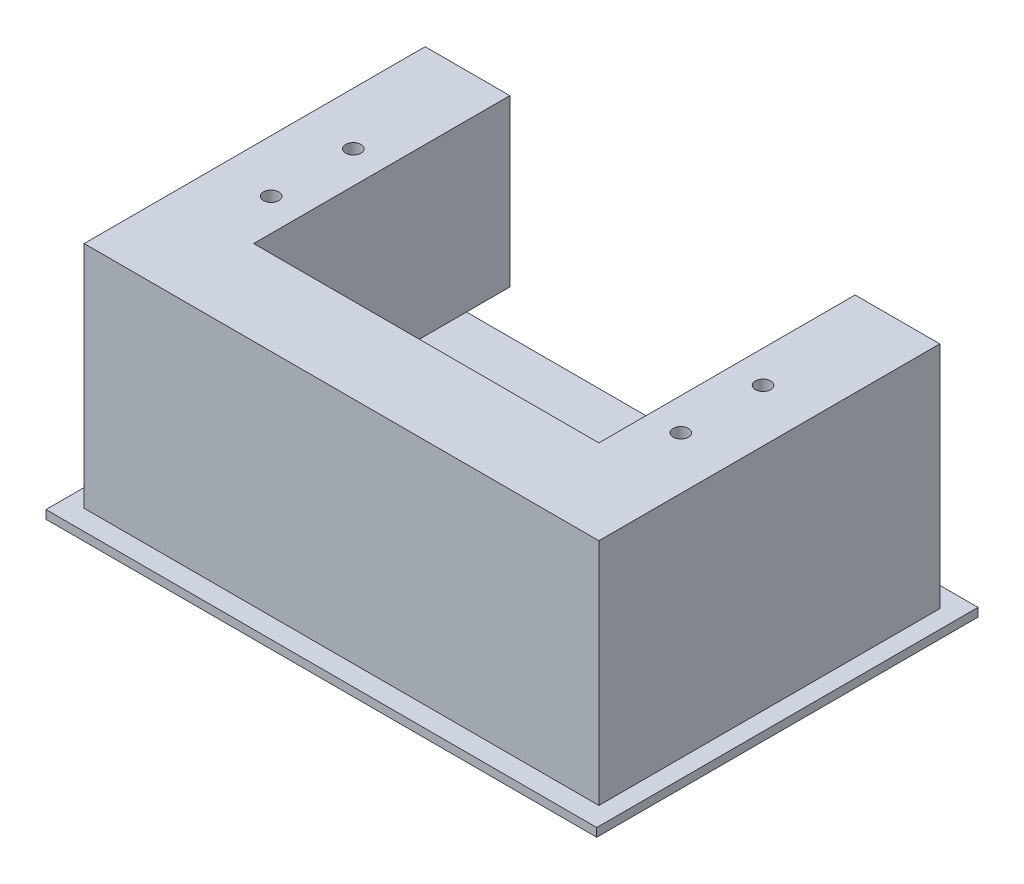
from build123d import *

# Parameters (mm, degrees)
SKETCH1_W           = 65
SKETCH1_H           = 45
BOSS_EXTRUDE1_DEPTH = 1
SKETCH2_W           = 10
SKETCH2_H           = 40.24
BOSS_EXTRUDE2_DEPTH = 27.06
CUT_EXTRUDE1_START  = -10
SKETCH3_R           = 0.9
CUT_EXTRUDE1_DEPTH  = 59.475391695
CUT_EXTRUDE2_REACH  = 74.435
SKETCH4_W           = 8.1
SKETCH4_H           = 7.5
SKETCH5_W           = 40.75
SKETCH5_H           = 10
BOSS_EXTRUDE3_DEPTH = 27.06
SKETCH6_W           = 16.07
SKETCH6_H           = 7.5
CUT_EXTRUDE3_DEPTH  = 50.75
SKETCH7_W           = 40.75
SKETCH7_H           = 10
CUT_EXTRUDE4_DEPTH  = 27.06


with BuildPart() as part:
    # Sketch1 → Boss-Extrude1 (new body)
    with BuildSketch(Plane(origin=(0, 0, 0), x_dir=(1, 0, 0), z_dir=(0, 1, 0))):
        Rectangle(SKETCH1_W, SKETCH1_H)
    extrude(amount=BOSS_EXTRUDE1_DEPTH)

    # Sketch2 → Boss-Extrude2 (add)
    with BuildSketch(Plane(origin=(0, 1, 0), x_dir=(1, 0, 0), z_dir=(0, 1, 0))):
        with Locations((25.375, 0)):
            Rectangle(SKETCH2_W, SKETCH2_H)
    boss_extrude2 = extrude(amount=BOSS_EXTRUDE2_DEPTH)

    # Sketch3 → Cut-Extrude1 (cut)
    with BuildSketch(Plane(origin=(0, 28.06, 0), x_dir=(1, 0, 0), z_dir=(0, 1, 0)).offset(CUT_EXTRUDE1_START)):
        with Locations(Location((24.175, 5.45, 0), (0, 0, 90))):
            Circle(SKETCH3_R)
        with Locations(Location((24.175, -4.25, 0), (0, 0, 90))):
            Circle(SKETCH3_R)
    cut_extrude1 = extrude(amount=CUT_EXTRUDE1_DEPTH, mode=Mode.SUBTRACT)

    # Mirror3: Boss-Extrude2, Cut-Extrude1 across plane
    add(boss_extrude2.mirror(Plane(origin=(0, 0, 0), x_dir=(0, 0, 1), z_dir=(1, 0, 0))))
    add(cut_extrude1.mirror(Plane(origin=(0, 0, 0), x_dir=(0, 0, 1), z_dir=(1, 0, 0))), mode=Mode.SUBTRACT)

    # Sketch4 → Cut-Extrude2 (cut, up to next)
    with BuildSketch(Plane.ZY.offset(30.375), mode=Mode.PRIVATE) as cut_extrude2_sk1:
        with Locations((0, 4.75)):
            Rectangle(SKETCH4_W, SKETCH4_H)
    cut_extrude2_tool1 = extrude(cut_extrude2_sk1.sketch, amount=-CUT_EXTRUDE2_REACH, mode=Mode.PRIVATE) & part.part
    add(cut_extrude2_tool1.solids().sort_by_distance((-30.375, 4.75, 0))[0], mode=Mode.SUBTRACT)

    # Sketch5 → Boss-Extrude3 (add)
    with BuildSketch(Plane(origin=(0, 1, 0), x_dir=(1, 0, 0), z_dir=(0, 1, 0))):
        with Locations((0, 15.12)):
            Rectangle(SKETCH5_W, SKETCH5_H)
    boss_extrude3 = extrude(amount=BOSS_EXTRUDE3_DEPTH)

    # Mirror4: Boss-Extrude3 across plane
    add(boss_extrude3.mirror(Plane.XY))

    # Sketch6 → Cut-Extrude3 (cut)
    with BuildSketch(Plane.ZY.offset(30.375)):
        with Locations((-12.085, 4.75)):
            Rectangle(SKETCH6_W, SKETCH6_H)
    extrude(amount=-CUT_EXTRUDE3_DEPTH, mode=Mode.SUBTRACT)

    # Sketch7 → Cut-Extrude4 (cut)
    with BuildSketch(Plane(origin=(0, 28.06, 0), x_dir=(1, 0, 0), z_dir=(0, 1, 0))):
        with Locations((0, 15.12)):
            Rectangle(SKETCH7_W, SKETCH7_H)
    extrude(amount=-CUT_EXTRUDE4_DEPTH, mode=Mode.SUBTRACT)


solid = part.part
